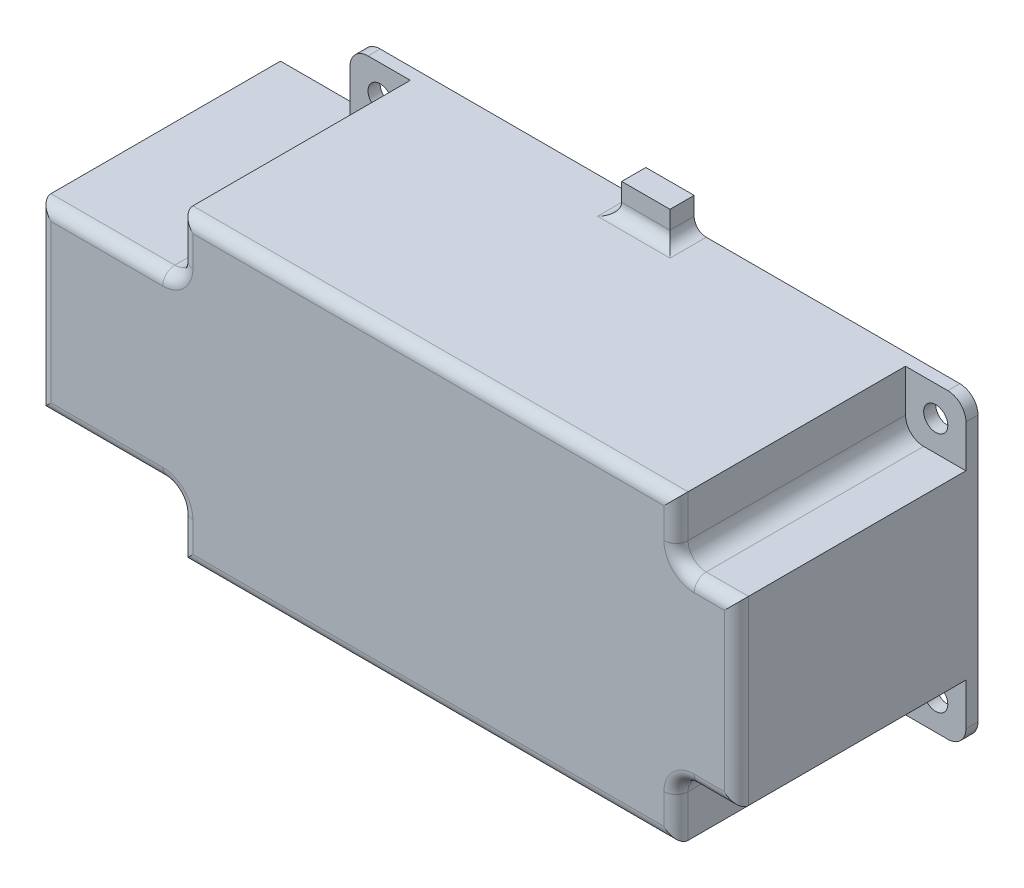
from build123d import *

# Parameters (mm, degrees)
CROQUIS1_W              = 102
CROQUIS1_H              = 50
SALIENTE_EXTRUIR1_DEPTH = 40
CORTAR_EXTRUIR1_DEPTH   = 38
CROQUIS4_R              = 2
CORTAR_EXTRUIR2_DEPTH   = 18
CORTAR_EXTRUIR3_DEPTH   = 38
CROQUIS7_W              = 6
CROQUIS7_H              = 3
CORTAR_EXTRUIR5_DEPTH   = 10
SALIENTE_EXTRUIR2_DEPTH = 5
CROQUIS9_W              = 6
CROQUIS9_H              = 1
SALIENTE_EXTRUIR3_DEPTH = 3
REDONDEO2_R             = 2
REDONDEO4_R             = 2
CROQUIS16_W             = 36.5
CROQUIS16_H             = 26.972151698
CORTAR_EXTRUIR13_DEPTH  = 5.5
CROQUIS17_W             = 40
CROQUIS17_H             = 30
CROQUIS17_W_2           = 36.5
CROQUIS17_H_2           = 26.972151698
SALIENTE_EXTRUIR7_DEPTH = 13.5
CROQUIS18_W             = 1.5
CROQUIS18_H             = 36.5
SALIENTE_EXTRUIR8_DEPTH = 27.5
CROQUIS19_R             = 11
CORTAR_EXTRUIR14_DEPTH  = 27.5
REDONDEO5_R             = 2


with BuildPart() as part:
    # Croquis1 → Saliente-Extruir1 (new body)
    with BuildSketch(Plane.XY):
        Rectangle(CROQUIS1_W, CROQUIS1_H)
    extrude(amount=SALIENTE_EXTRUIR1_DEPTH)

    # Croquis3 → Cortar-Extruir1 (cut)
    with BuildSketch(Plane.XY.offset(40)):
        with BuildLine():
            Line((51, 25), (41, 25))
            Line((41, 25), (41, 18))
            ThreePointArc((41, 18), (41.878679656, 15.878679656), (44, 15))
            Line((44, 15), (51, 15))
            Line((51, 15), (51, 25))
        make_face()
        with BuildLine():
            Line((41, -18), (41, -25))
            Line((41, -25), (51, -25))
            Line((51, -25), (51, -15))
            Line((51, -15), (44, -15))
            ThreePointArc((44, -15), (41.878679656, -15.878679656), (41, -18))
        make_face()
        with BuildLine():
            Line((-44, -15), (-51, -15))
            Line((-51, -15), (-51, -25))
            Line((-51, -25), (-41, -25))
            Line((-41, -25), (-41, -18))
            ThreePointArc((-41, -18), (-41.878679656, -15.878679656), (-44, -15))
        make_face()
        with BuildLine():
            Line((-51, 25), (-51, 15))
            Line((-51, 15), (-44, 15))
            ThreePointArc((-44, 15), (-41.878679656, 15.878679656), (-41, 18))
            Line((-41, 18), (-41, 25))
            Line((-41, 25), (-51, 25))
        make_face()
    extrude(amount=-CORTAR_EXTRUIR1_DEPTH, mode=Mode.SUBTRACT)

    # Croquis4 → Cortar-Extruir2 (cut)
    with BuildSketch(Plane.XY.offset(2)):
        with BuildLine():
            Line((-51, -25), (-48, -25))
            ThreePointArc((-48, -25), (-50.121320344, -24.121320344), (-51, -22))
            Line((-51, -22), (-51, -25))
        make_face()
        with Locations((-46, -20)):
            Circle(CROQUIS4_R)
        with BuildLine():
            Line((-51, 25), (-51, 22))
            ThreePointArc((-51, 22), (-50.121320344, 24.121320344), (-48, 25))
            Line((-48, 25), (-51, 25))
        make_face()
        with Locations((-46, 20)):
            Circle(CROQUIS4_R)
        with Locations((46, 20)):
            Circle(CROQUIS4_R)
        with BuildLine():
            ThreePointArc((48, 25), (50.121320344, 24.121320344), (51, 22))
            Line((51, 22), (51, 25))
            Line((51, 25), (48, 25))
        make_face()
        with Locations((46, -20)):
            Circle(CROQUIS4_R)
        with BuildLine():
            ThreePointArc((51, -22), (50.121320344, -24.121320344), (48, -25))
            Line((48, -25), (51, -25))
            Line((51, -25), (51, -22))
        make_face()
    extrude(amount=-CORTAR_EXTRUIR2_DEPTH, mode=Mode.SUBTRACT)

    # Croquis5 → Cortar-Extruir3 (cut)
    with BuildSketch(Plane(origin=(0, 0, 0), x_dir=(-1, 0, 0), z_dir=(0, 0, -1))):
        with BuildLine():
            Line((0, 23.5), (-39.490487895, 23.5))
            Line((-39.490487895, 23.5), (-39.490487895, 15.5))
            ThreePointArc((-39.490487895, 15.5), (-40.076274332, 14.085786438), (-41.490487895, 13.5))
            Line((-41.490487895, 13.5), (-49.525351845, 13.5))
            Line((-49.525351845, 13.5), (-49.525351845, -13.472151698))
            Line((-49.525351845, -13.472151698), (-41.490487895, -13.472151698))
            ThreePointArc((-41.490487895, -13.472151698), (-40.076274332, -14.057938136), (-39.490487895, -15.472151698))
            Line((-39.490487895, -15.472151698), (-39.490487895, -23.5))
            Line((-39.490487895, -23.5), (39.5, -23.5))
            Line((39.5, -23.5), (39.5, -15.472151698))
            ThreePointArc((39.5, -15.472151698), (40.085786438, -14.057938136), (41.5, -13.472151698))
            Line((41.5, -13.472151698), (49.474648155, -13.472151698))
            Line((49.474648155, -13.472151698), (49.474648155, 13.5))
            Line((49.474648155, 13.5), (41.5, 13.5))
            ThreePointArc((41.5, 13.5), (40.085786438, 14.085786438), (39.5, 15.5))
            Line((39.5, 15.5), (39.5, 23.5))
            Line((39.5, 23.5), (0, 23.5))
        make_face()
    extrude(amount=-CORTAR_EXTRUIR3_DEPTH, mode=Mode.SUBTRACT)

    # Croquis7 → Cortar-Extruir5 (cut)
    with BuildSketch(Plane(origin=(0, 25, 0), x_dir=(1, 0, 0), z_dir=(0, 1, 0))):
        with Locations((0, -1.5)):
            Rectangle(CROQUIS7_W, CROQUIS7_H)
    extrude(amount=-CORTAR_EXTRUIR5_DEPTH, mode=Mode.SUBTRACT)

    # Croquis8 → Saliente-Extruir2 (add)
    with BuildSketch(Plane(origin=(0, 25, 0), x_dir=(1, 0, 0), z_dir=(0, 1, 0))):
        Polygon((3, 0), (4, 0), (4, -4), (-4, -4), (-4, 0), (-3, 0), (-3, -3), (3, -3), align=None)
    extrude(amount=SALIENTE_EXTRUIR2_DEPTH)

    # Croquis9 → Saliente-Extruir3 (add)
    with BuildSketch(Plane(origin=(0, 0, 3), x_dir=(-1, 0, 0), z_dir=(0, 0, -1))):
        with Locations((0, 29.5)):
            Rectangle(CROQUIS9_W, CROQUIS9_H)
    extrude(amount=SALIENTE_EXTRUIR3_DEPTH)

    # Redondeo2
    redondeo2_edges = [part.edges().sort_by_distance(p)[0] for p in [
        (0, 23.5, 3),
    ]]
    fillet(redondeo2_edges, radius=REDONDEO2_R)

    # Redondeo4
    redondeo4_edges = [part.edges().sort_by_distance(p)[0] for p in [
        (-4, 25, 2),
        (0, 25, 4),
        (4, 25, 2),
    ]]
    fillet(redondeo4_edges, radius=REDONDEO4_R)

    # Croquis16 → Cortar-Extruir13 (cut)
    with BuildSketch(Plane(origin=(-49.474648155, 0, 0), x_dir=(0, 0, -1), z_dir=(1, 0, 0))):
        with Locations((-19.75, 0.013924151)):
            Rectangle(CROQUIS16_W, CROQUIS16_H)
    extrude(amount=-CORTAR_EXTRUIR13_DEPTH, mode=Mode.SUBTRACT)

    # Croquis17 → Saliente-Extruir7 (add)
    with BuildSketch(Plane.ZY.offset(51)):
        with Locations((20, 0)):
            Rectangle(CROQUIS17_W, CROQUIS17_H)
        with Locations((19.75, 0.013924151)):
            Rectangle(CROQUIS17_W_2, CROQUIS17_H_2, mode=Mode.SUBTRACT)
    extrude(amount=SALIENTE_EXTRUIR7_DEPTH)

    # Croquis18 → Saliente-Extruir8 (add)
    with BuildSketch(Plane.XZ.offset(-13.5)):
        with Locations((-63.75, 19.75)):
            Rectangle(CROQUIS18_W, CROQUIS18_H)
    extrude(amount=SALIENTE_EXTRUIR8_DEPTH)

    # Croquis19 → Cortar-Extruir14 (cut)
    with BuildSketch(Plane.ZY.offset(64.5)):
        with Locations((20, 0)):
            Circle(CROQUIS19_R)
    extrude(amount=-CORTAR_EXTRUIR14_DEPTH, mode=Mode.SUBTRACT)

    # Redondeo5
    redondeo5_edges = [part.edges().sort_by_distance(p)[0] for p in [
        (51, 0, 40),
        (0, 25, 40),
        (0, -25, 40),
        (-41.878679656, 15.878679656, 40),
        (-41, 21.5, 40),
        (-64.5, 0, 40),
        (-54.25, 15, 40),
        (-41.878679656, -15.878679656, 40),
        (-41, -21.5, 40),
        (-54.25, -15, 40),
        (41.878679656, -15.878679656, 40),
        (47.5, -15, 40),
        (41, -21.5, 40),
        (41.878679656, 15.878679656, 40),
        (47.5, 15, 40),
        (41, 21.5, 40),
    ]]
    fillet(redondeo5_edges, radius=REDONDEO5_R)


solid = part.part
